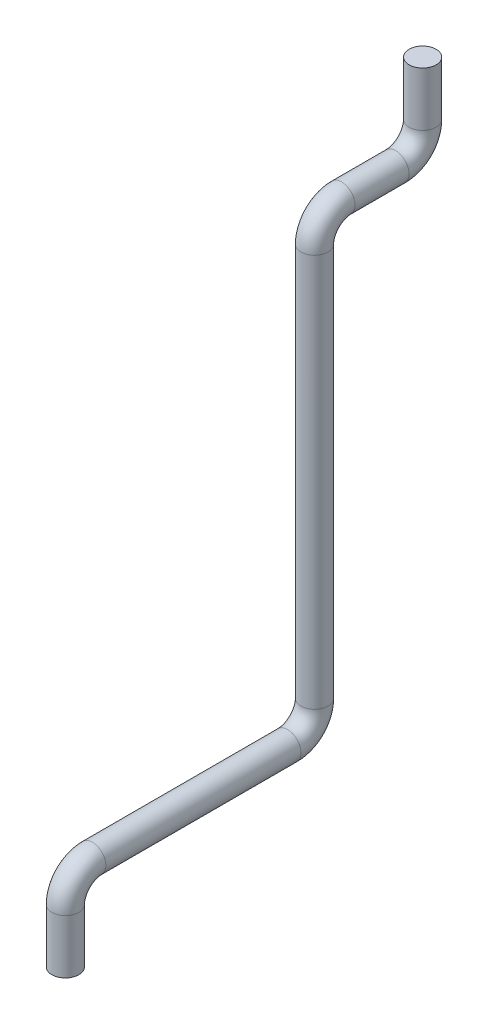
from build123d import *

# Parameters (mm, degrees)
SKETCH2_R = 0.5


with BuildPart() as part:
    # Sweep1: sweep along a path in Sketch1
    with BuildLine(Plane(origin=(0, 0, 0), x_dir=(0, 0, -1), z_dir=(1, 0, 0))) as sweep1_path:
        Line((0, 0), (0, 2))
        ThreePointArc((0, 2), (0.292893219, 2.707106781), (1, 3))
        Line((1, 3), (8.22, 3))
        ThreePointArc((8.22, 3), (8.927106781, 3.292893219), (9.22, 4))
        Line((9.22, 4), (9.22, 18.55))
        ThreePointArc((9.22, 18.55), (9.512893219, 19.257106781), (10.22, 19.55))
        Line((10.22, 19.55), (12.22, 19.55))
        ThreePointArc((12.22, 19.55), (12.927106781, 19.842893219), (13.22, 20.55))
        Line((13.22, 20.55), (13.22, 22.55))
    # Sketch2 → Sweep1 (sweep)
    with BuildSketch(Plane(origin=(0, 0, 0), x_dir=(1, 0, 0), z_dir=(0, 1, 0))):
        Circle(SKETCH2_R)
    sweep(path=sweep1_path.line)


solid = part.part
